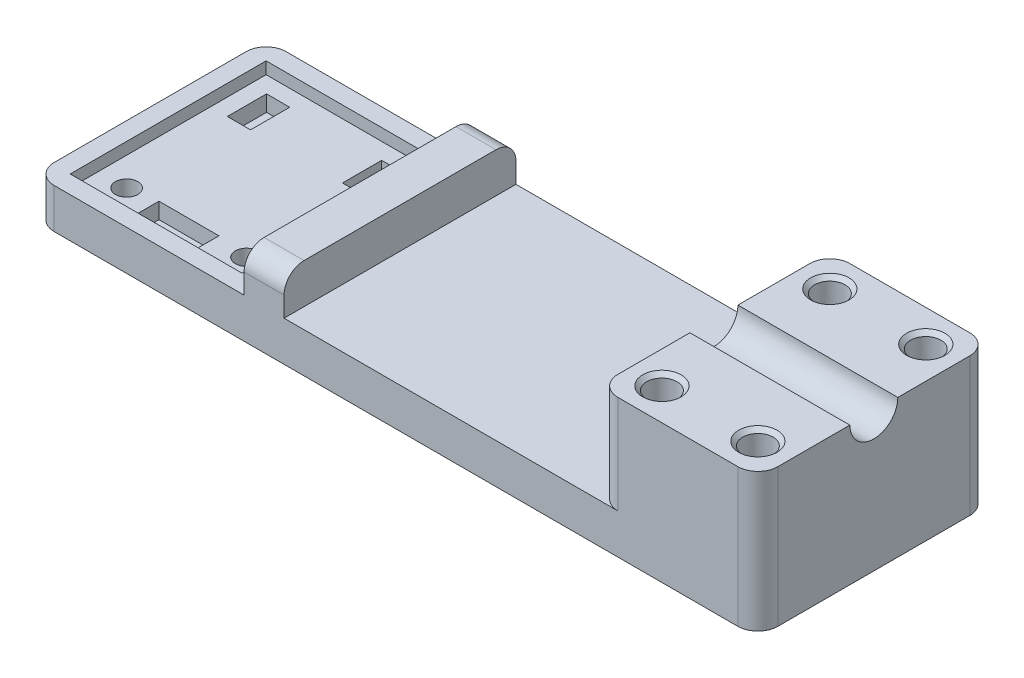
from build123d import *

# Parameters (mm, degrees)
P_IDAT_VYSUNUT_M1_DEPTH  = 29
SKICA2_W                 = 21.5
SKICA2_H                 = 24.5
ODEBRAT_VYSUNUT_M1_DEPTH = 1.5
SKICA3_R                 = 1.4
ODEBRAT_VYSUNUT_M2_DEPTH = 3.5
SKICA6_W                 = 2.9
SKICA6_H                 = 4.9
SKICA6_W_2               = 7.5
SKICA6_H_2               = 2.9
ODEBRAT_VYSUNUT_M5_DEPTH = 2
ZAOBLIT1_R               = 2.5
ZAOBLIT2_R               = 2.5
SKICA10_R                = 1.9
ODEBRAT_VYSUNUT_M7_DEPTH = 17.3
SKICA20_R                = 3
ODEBRAT_VYSUNUT_M8_DEPTH = 20
ZKOSEN_1_SIZE            = 0.5
SKICA21_W                = 5
SKICA21_H                = 29
P_IDAT_VYSUNUT_M2_DEPTH  = 5
ZAOBLIT4_R               = 2.5


with BuildPart() as part:
    # Skica1 → Přidat vysunutím1 (new body)
    with BuildSketch(Plane.XY):
        Polygon((0, 0), (90.5, 0), (90.5, 17.3), (70.5, 17.3), (70.5, 5), (0, 5), align=None)
    extrude(amount=P_IDAT_VYSUNUT_M1_DEPTH)

    # Skica2 → Odebrat vysunutím1 (cut)
    with BuildSketch(Plane(origin=(0, 5, 0), x_dir=(1, 0, 0), z_dir=(0, 1, 0))):
        with Locations((13, -14.5)):
            Rectangle(SKICA2_W, SKICA2_H)
    extrude(amount=-ODEBRAT_VYSUNUT_M1_DEPTH, mode=Mode.SUBTRACT)

    # Skica3 → Odebrat vysunutím2 (cut)
    with BuildSketch(Plane(origin=(0, 3.5, 0), x_dir=(1, 0, 0), z_dir=(0, 1, 0))):
        with Locations(Location((20.8, -23.25, 0), (0, 0, 180))):
            Circle(SKICA3_R)
        with Locations(Location((5.8, -23.25, 0), (0, 0, 180))):
            Circle(SKICA3_R)
    extrude(amount=-ODEBRAT_VYSUNUT_M2_DEPTH, mode=Mode.SUBTRACT)

    # Skica6 → Odebrat vysunutím5 (cut)
    with BuildSketch(Plane(origin=(0, 3.5, 0), x_dir=(1, 0, 0), z_dir=(0, 1, 0))):
        with Locations((5.8, -6.75)):
            Rectangle(SKICA6_W, SKICA6_H)
        with Locations((20.2, -6.75)):
            Rectangle(SKICA6_W, SKICA6_H)
        with Locations((13, -24.1)):
            Rectangle(SKICA6_W_2, SKICA6_H_2)
    extrude(amount=-ODEBRAT_VYSUNUT_M5_DEPTH, mode=Mode.SUBTRACT)

    # Zaoblit1
    zaoblit1_edges = [part.edges().sort_by_distance(p)[0] for p in [
        (0, 2.5, 29),
        (0, 2.5, 0),
    ]]
    fillet(zaoblit1_edges, radius=ZAOBLIT1_R)

    # Zaoblit2
    zaoblit2_edges = [part.edges().sort_by_distance(p)[0] for p in [
        (90.5, 8.65, 29),
        (70.5, 11.15, 29),
        (70.5, 11.15, 0),
        (90.5, 8.65, 0),
    ]]
    fillet(zaoblit2_edges, radius=ZAOBLIT2_R)

    # Skica10 → Odebrat vysunutím7 (cut)
    with BuildSketch(Plane(origin=(0, 17.3, 0), x_dir=(1, 0, 0), z_dir=(0, 1, 0))):
        with Locations(Location((74.5, -4, 0), (0, 0, 180))):
            Circle(SKICA10_R)
        with Locations(Location((86.5, -4, 0), (0, 0, 180))):
            Circle(SKICA10_R)
        with Locations(Location((86.5, -25, 0), (0, 0, 270))):
            Circle(SKICA10_R)
        with Locations(Location((74.5, -25, 0), (0, 0, 270))):
            Circle(SKICA10_R)
    extrude(amount=-ODEBRAT_VYSUNUT_M7_DEPTH, mode=Mode.SUBTRACT)

    # Skica20 → Odebrat vysunutím8 (cut)
    with BuildSketch(Plane(origin=(90.5, 0, 0), x_dir=(0, 0, -1), z_dir=(1, 0, 0))):
        with Locations((-14.5, 17.3)):
            Circle(SKICA20_R)
    extrude(amount=-ODEBRAT_VYSUNUT_M8_DEPTH, mode=Mode.SUBTRACT)

    # Zkosení1
    zkosen_1_edges = [part.edges().sort_by_distance(p)[0] for p in [
        (74.5, 17.3, 23.1),
        (86.5, 17.3, 23.1),
        (88.4, 17.3, 4),
        (76.4, 17.3, 4),
    ]]
    chamfer(zkosen_1_edges, length=ZKOSEN_1_SIZE)

    # Skica21 → Přidat vysunutím2 (add)
    with BuildSketch(Plane(origin=(0, 5, 0), x_dir=(1, 0, 0), z_dir=(0, 1, 0))):
        with Locations((28.745471576, -14.5)):
            Rectangle(SKICA21_W, SKICA21_H)
    extrude(amount=P_IDAT_VYSUNUT_M2_DEPTH)

    # Zaoblit4
    zaoblit4_edges = [part.edges().sort_by_distance(p)[0] for p in [
        (28.745471576, 10, 29),
        (28.745471576, 10, 0),
    ]]
    fillet(zaoblit4_edges, radius=ZAOBLIT4_R)


solid = part.part
